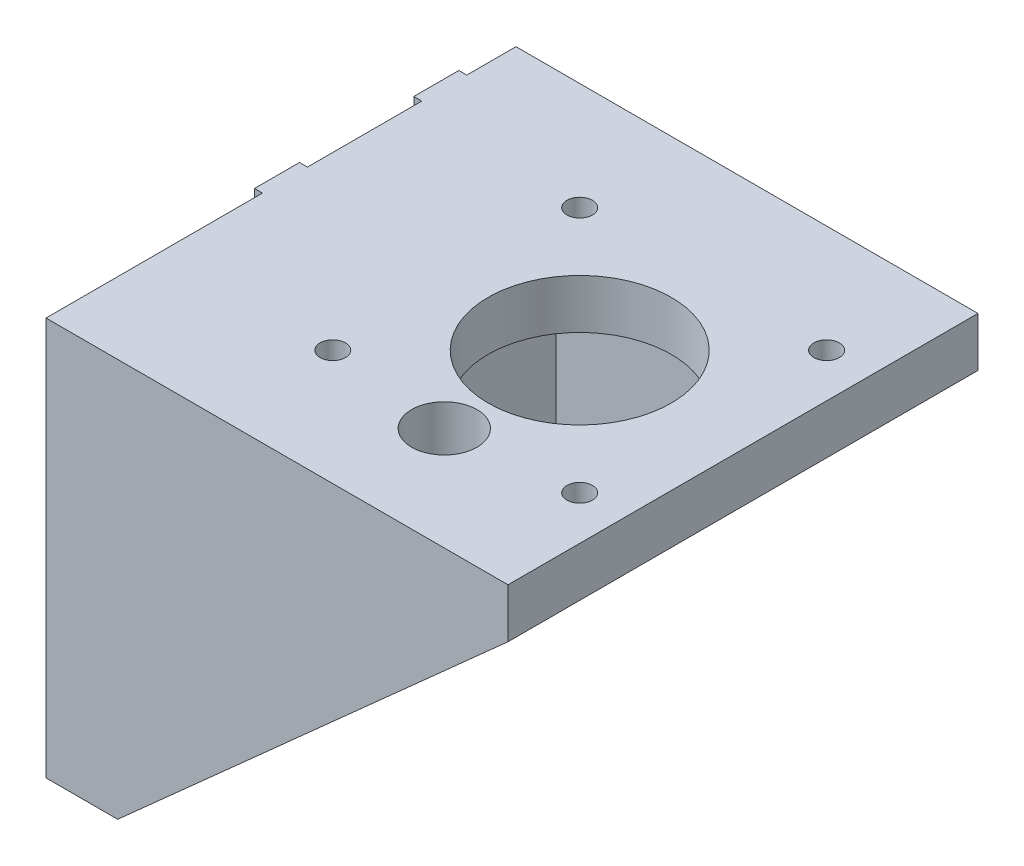
from build123d import *

# Parameters (mm, degrees)
RESSALTO_EXTRUS_O1_DEPTH = 59
ESBO_O2_W                = 50
ESBO_O2_H                = 43.8
CORTE_EXTRUS_O1_DEPTH    = 49
ESBO_O3_R                = 1.75
CORTE_EXTRUS_O2_DEPTH    = 92.553263186
ESBO_O4_W                = 5.65
ESBO_O4_H                = 50
ESBO_O4_R                = 1.75
RESSALTO_EXTRUS_O2_DEPTH = 1
ESBO_O5_R                = 4.35
CORTE_EXTRUS_O3_DEPTH    = 4
ESBO_O6_R                = 11.5
ESBO_O6_R_2              = 1.6
ESBO_O6_R_3              = 4.1
CORTE_EXTRUS_O4_DEPTH    = 6.2


with BuildPart() as part:
    # Esboço1 → Ressalto-extrusão1 (new body)
    with BuildSketch(Plane.XY):
        Polygon((9, 0), (58, 43.8), (58, 50), (0, 50), (0, 0), align=None)
    extrude(amount=RESSALTO_EXTRUS_O1_DEPTH)

    # Esboço2 → Corte-extrusão1 (cut)
    with BuildSketch(Plane(origin=(58, 0, 0), x_dir=(0, 0, -1), z_dir=(1, 0, 0))):
        with Locations((-29, 21.9)):
            Rectangle(ESBO_O2_W, ESBO_O2_H)
    extrude(amount=-CORTE_EXTRUS_O1_DEPTH, mode=Mode.SUBTRACT)

    # Esboço3 → Corte-extrusão2 (cut, through all)
    with BuildSketch(Plane(origin=(9, 0, 0), x_dir=(0, 0, -1), z_dir=(1, 0, 0))):
        with Locations((-29, 11.9)):
            Circle(ESBO_O3_R)
        with Locations((-29, 31.9)):
            Circle(ESBO_O3_R)
        with Locations((-9, 31.9)):
            Circle(ESBO_O3_R)
        with Locations((-9, 11.9)):
            Circle(ESBO_O3_R)
    extrude(amount=-CORTE_EXTRUS_O2_DEPTH, mode=Mode.SUBTRACT)

    # Esboço4 → Ressalto-extrusão2 (add)
    # profile 1 of 2: a face of its own
    with BuildSketch(Plane.ZY):
        with Locations((9, 25)):
            Rectangle(ESBO_O4_W, ESBO_O4_H)
        with Locations(Location((9, 11.9, 0), (0, 0, 180))):
            Circle(ESBO_O4_R, mode=Mode.SUBTRACT)
        with Locations(Location((9, 31.9, 0), (0, 0, 180))):
            Circle(ESBO_O4_R, mode=Mode.SUBTRACT)
    # profile 2 of 2: a face of its own
    with BuildSketch(Plane.ZY):
        with Locations((29, 25)):
            Rectangle(ESBO_O4_W, ESBO_O4_H)
        with Locations(Location((29, 11.9, 0), (0, 0, 180))):
            Circle(ESBO_O4_R, mode=Mode.SUBTRACT)
        with Locations(Location((29, 31.9, 0), (0, 0, 180))):
            Circle(ESBO_O4_R, mode=Mode.SUBTRACT)
    extrude(amount=RESSALTO_EXTRUS_O2_DEPTH)

    # Esboço5 → Corte-extrusão3 (cut)
    with BuildSketch(Plane(origin=(9, 0, 0), x_dir=(0, 0, -1), z_dir=(1, 0, 0))):
        with Locations((-29, 31.9)):
            Circle(ESBO_O5_R)
        with Locations((-9, 31.9)):
            Circle(ESBO_O5_R)
        with Locations((-29, 11.9)):
            Circle(ESBO_O5_R)
        with Locations((-9, 11.9)):
            Circle(ESBO_O5_R)
    extrude(amount=-CORTE_EXTRUS_O3_DEPTH, mode=Mode.SUBTRACT)

    # Esboço6 → Corte-extrusão4 (cut)
    with BuildSketch(Plane(origin=(0, 50, 0), x_dir=(1, 0, 0), z_dir=(0, 1, 0))):
        with Locations(Location((37, -29, 0), (0, 0, 270))):
            Circle(ESBO_O6_R)
        with Locations(Location((21.5, -13.5, 0), (0, 0, 270))):
            Circle(ESBO_O6_R_2)
        with Locations(Location((52.5, -13.5, 0), (0, 0, 270))):
            Circle(ESBO_O6_R_2)
        with Locations(Location((52.5, -44.5, 0), (0, 0, 270))):
            Circle(ESBO_O6_R_2)
        with Locations(Location((21.5, -44.5, 0), (0, 0, 270))):
            Circle(ESBO_O6_R_2)
        with Locations(Location((37, -46, 0), (0, 0, 270))):
            Circle(ESBO_O6_R_3)
    extrude(amount=-CORTE_EXTRUS_O4_DEPTH, mode=Mode.SUBTRACT)


solid = part.part
